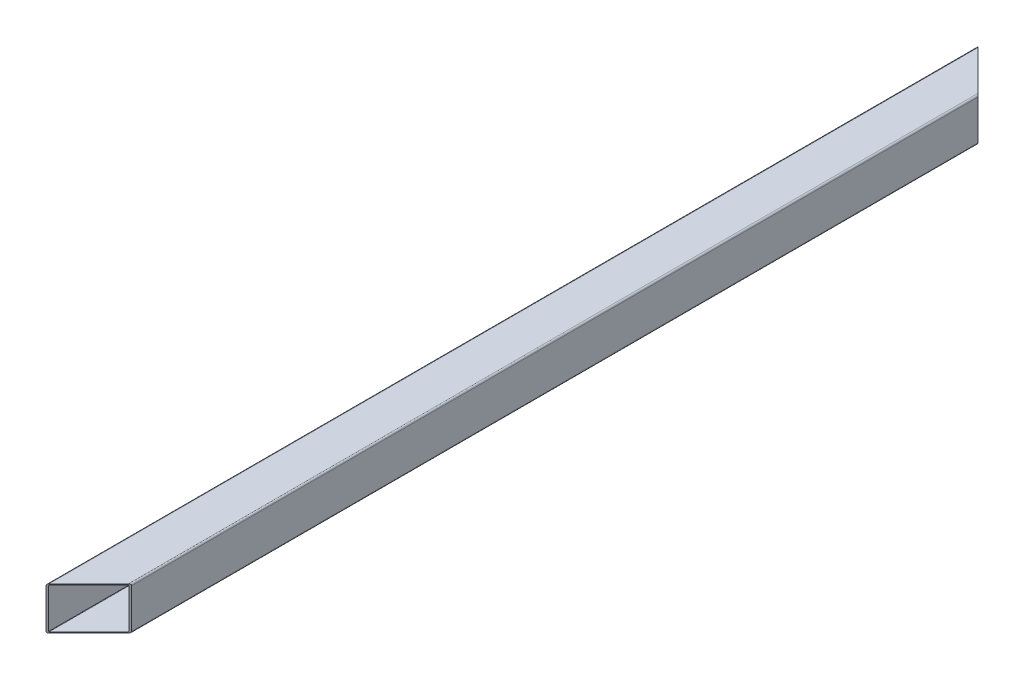
from build123d import *

# Parameters (mm, degrees)
STRUCTURAL_MEMBER1_DEPTH = 870
CUT_EXTRUDE2_DEPTH       = 375


with BuildPart() as part:
    # Sketch12 → Structural Member1 (new body)
    with BuildSketch(Plane(origin=(0, 0, 0), x_dir=(-1, 0, 0), z_dir=(0, 0, -1))):
        with BuildLine():
            Line((-18.5, -20), (18.5, -20))
            ThreePointArc((18.5, -20), (19.560660172, -19.560660172), (20, -18.5))
            Line((20, -18.5), (20, 18.5))
            ThreePointArc((20, 18.5), (19.560660172, 19.560660172), (18.5, 20))
            Line((18.5, 20), (-18.5, 20))
            ThreePointArc((-18.5, 20), (-19.560660172, 19.560660172), (-20, 18.5))
            Line((-20, 18.5), (-20, -18.5))
            ThreePointArc((-20, -18.5), (-19.560660172, -19.560660172), (-18.5, -20))
        make_face()
        with BuildLine():
            Line((-18.5, -18.8), (18.5, -18.8))
            ThreePointArc((18.5, -18.8), (18.712132034, -18.712132034), (18.8, -18.5))
            Line((18.8, -18.5), (18.8, 18.5))
            ThreePointArc((18.8, 18.5), (18.712132034, 18.712132034), (18.5, 18.8))
            Line((18.5, 18.8), (-18.5, 18.8))
            ThreePointArc((-18.5, 18.8), (-18.712132034, 18.712132034), (-18.8, 18.5))
            Line((-18.8, 18.5), (-18.8, -18.5))
            ThreePointArc((-18.8, -18.5), (-18.712132034, -18.712132034), (-18.5, -18.8))
        make_face(mode=Mode.SUBTRACT)
    extrude(amount=STRUCTURAL_MEMBER1_DEPTH)

    # Sketch14 → Cut-Extrude2 (cut)
    with BuildSketch(Plane(origin=(0, 50, 0), x_dir=(1, 0, 0), z_dir=(0, 1, 0))):
        Polygon((-20, 870), (54.165109429, 795.834890571), (54.165109429, 870), align=None)
        Polygon((-20, 0), (47.823796094, 67.823796094), (47.823796094, 0), align=None)
    extrude(amount=-CUT_EXTRUDE2_DEPTH, mode=Mode.SUBTRACT)


solid = part.part
